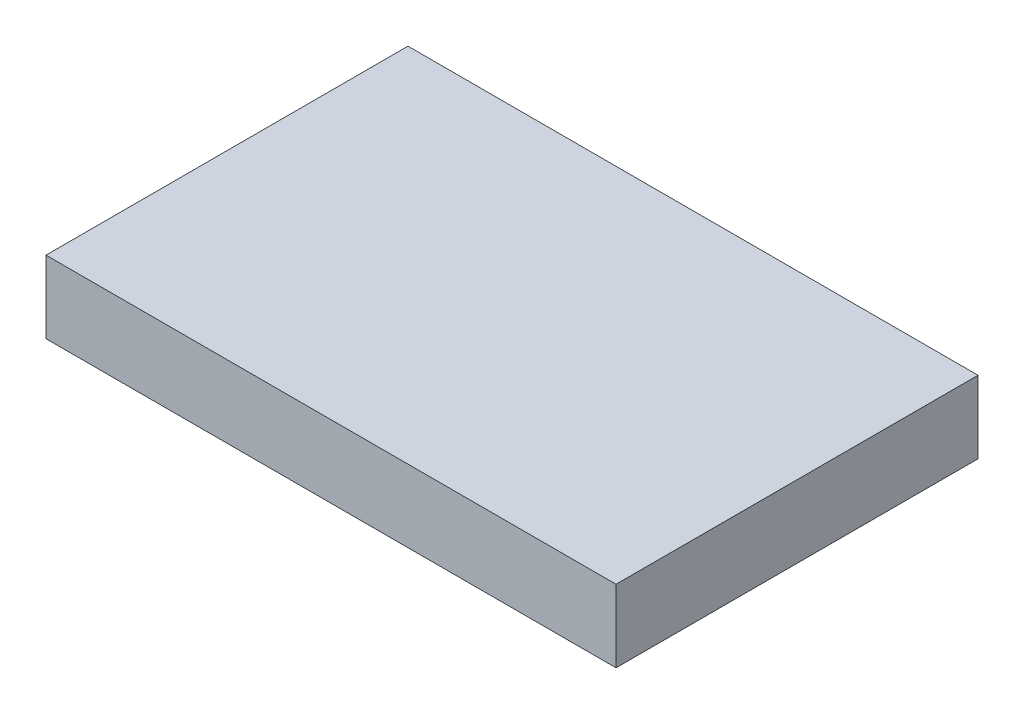
from build123d import *

# Parameters (mm, degrees)
SKETCH1_W           = 200
SKETCH1_H           = 127
BOSS_EXTRUDE1_DEPTH = 25.4


with BuildPart() as part:
    # Sketch1 → Boss-Extrude1 (new body)
    with BuildSketch(Plane(origin=(0, 0, 0), x_dir=(1, 0, 0), z_dir=(0, 1, 0))):
        with Locations((100, 63.5)):
            Rectangle(SKETCH1_W, SKETCH1_H)
    extrude(amount=BOSS_EXTRUDE1_DEPTH)


solid = part.part
